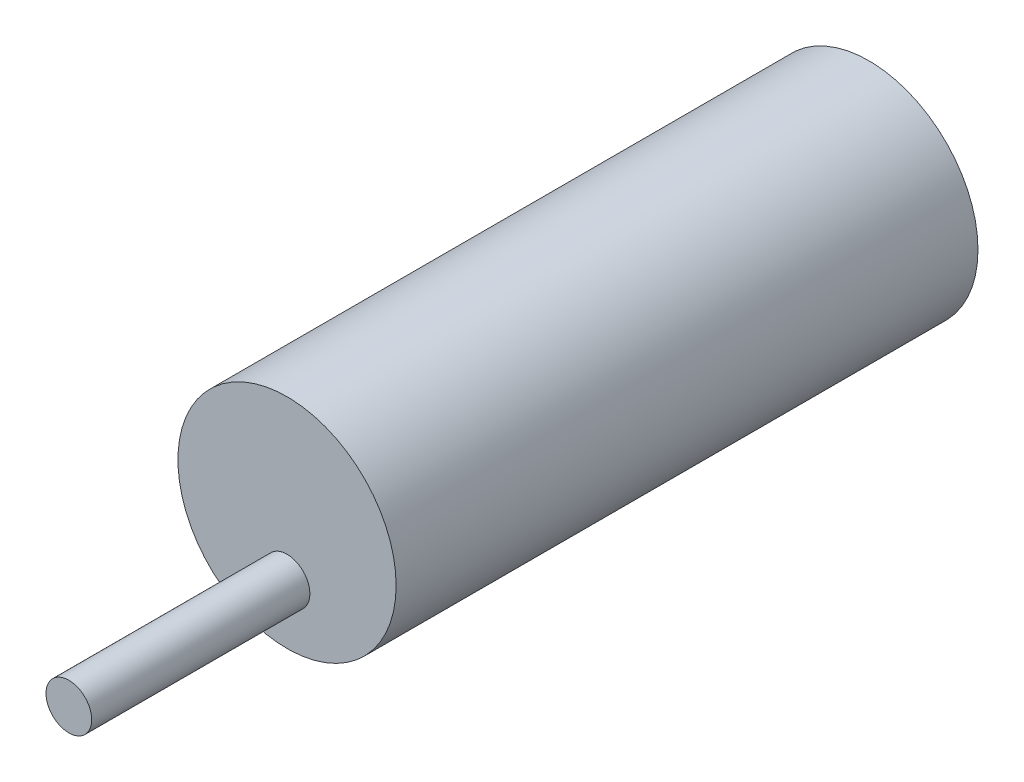
from build123d import *

# Parameters (mm, degrees)
SKETCH1_R           = 19.05
BOSS_EXTRUDE1_DEPTH = 101.6
SKETCH2_R           = 3.9878
BOSS_EXTRUDE2_DEPTH = 38.1


with BuildPart() as part:
    # Sketch1 → Boss-Extrude1 (new body)
    with BuildSketch(Plane.XY):
        Circle(SKETCH1_R)
    extrude(amount=BOSS_EXTRUDE1_DEPTH)

    # Sketch2 → Boss-Extrude2 (add)
    with BuildSketch(Plane.XY.offset(101.6)):
        with Locations(Location((0, -8.767927131, 0), (0, 0, 180))):
            Circle(SKETCH2_R)
    extrude(amount=BOSS_EXTRUDE2_DEPTH)


solid = part.part
